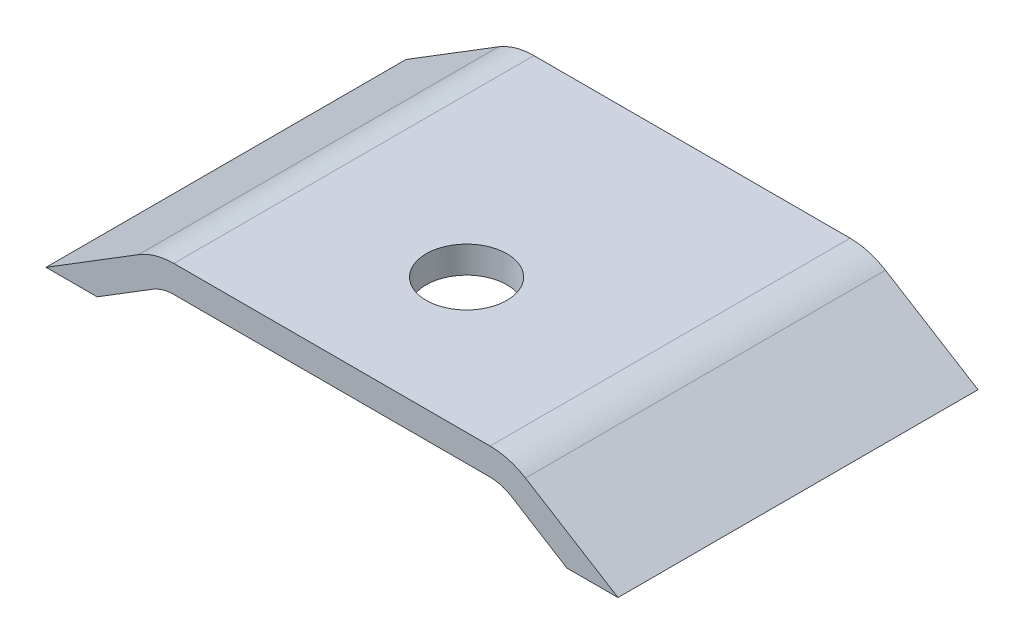
from build123d import *

# Parameters (mm, degrees)
BOSS_EXTRUDE1_DEPTH = 67.945
FILLET1_R           = 12.7
CUT_EXTRUDE1_REACH  = 89.007
CUT_EXTRUDE2_REACH  = 89.699
SKETCH5_R           = 7.62


with BuildPart() as part:
    # Sketch1 → Boss-Extrude1 (new body)
    with BuildSketch(Plane.XY):
        Polygon((-53.975, -6.35), (-33.449406604, 6.35), (33.449406604, 6.35), (53.975, -6.35), align=None)
    extrude(amount=BOSS_EXTRUDE1_DEPTH)

    # Fillet1
    fillet1_edges = [part.edges().sort_by_distance(p)[0] for p in [
        (-33.449406604, 6.35, 33.9725),
        (33.449406604, 6.35, 33.9725),
    ]]
    fillet(fillet1_edges, radius=FILLET1_R)

    # Sketch3 → Cut-Extrude1 (cut, up to next)
    with BuildSketch(Plane.XY.offset(67.945), mode=Mode.PRIVATE) as cut_extrude1_sk1:
        with BuildLine():
            Line((-51.302080212, -10.669942107), (51.302080212, -10.669942107))
            Line((51.302080212, -10.669942107), (33.847478799, 0.12991316))
            ThreePointArc((33.847478799, 0.12991316), (31.922261025, 0.979438528), (29.838099116, 1.27))
            Line((29.838099116, 1.27), (-29.838099116, 1.27))
            ThreePointArc((-29.838099116, 1.27), (-31.922261025, 0.979438528), (-33.847478799, 0.12991316))
            Line((-33.847478799, 0.12991316), (-51.302080212, -10.669942107))
        make_face()
    cut_extrude1_tool1 = extrude(cut_extrude1_sk1.sketch, amount=-CUT_EXTRUDE1_REACH, mode=Mode.PRIVATE) & part.part
    add(cut_extrude1_tool1.solids().sort_by_distance((0, -5.166229, 67.945))[0], mode=Mode.SUBTRACT)

    # Sketch5 → Cut-Extrude2 (cut, up to next)
    with BuildSketch(Plane(origin=(0, 6.35, 0), x_dir=(1, 0, 0), z_dir=(0, 1, 0)), mode=Mode.PRIVATE) as cut_extrude2_sk1:
        with Locations(Location((0, -42.545, 0), (0, 0, 180))):
            Circle(SKETCH5_R)
    cut_extrude2_tool1 = extrude(cut_extrude2_sk1.sketch, amount=-CUT_EXTRUDE2_REACH, mode=Mode.PRIVATE) & part.part
    add(cut_extrude2_tool1.solids().sort_by_distance((0, 6.35, 42.545))[0], mode=Mode.SUBTRACT)


solid = part.part
